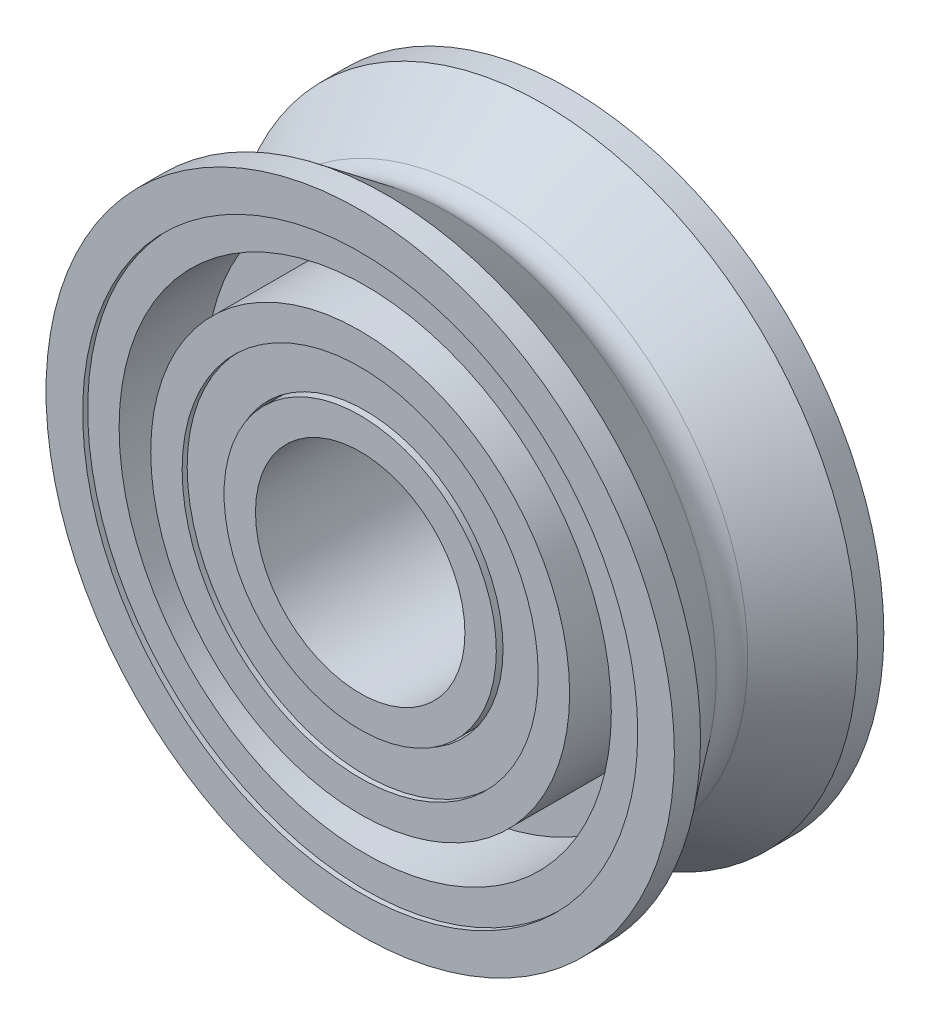
from build123d import *

# Parameters (mm, degrees)
CUT_EXTRUDE_THIN1_DEPTH      = 7.919752073
CUT_EXTRUDE_THIN1_DEPTH_BACK = 7.919752073
SKETCH2_R                    = 2.08915
SKETCH2_R_2                  = 2.06375


with BuildPart() as part:
    # Sketch1 → Revolve1 (revolve)
    with BuildSketch(Plane(origin=(0, 0, 0), x_dir=(0, 0, -1), z_dir=(1, 0, 0)), mode=Mode.PRIVATE) as revolve1_sk:
        with BuildLine():
            Line((1.190625, 4.7625), (1.5875, 4.7625))
            Line((1.5875, 4.7625), (1.5875, 4.206875))
            Line((1.5875, 4.206875), (1.5113, 4.206875))
            Line((1.5113, 4.206875), (1.5113, 3.730625))
            Line((1.5113, 3.730625), (0.1984375, 3.730625))
            Line((0.1984375, 3.730625), (0.1984375, 3.175))
            Line((0.1984375, 3.175), (1.5875, 3.175))
            Line((1.5875, 3.175), (1.5875, 2.69875))
            Line((1.5875, 2.69875), (1.5113, 2.69875))
            Line((1.5113, 2.69875), (1.5113, 2.06375))
            Line((1.5113, 2.06375), (1.5875, 2.06375))
            Line((1.5875, 2.06375), (1.5875, 1.5875))
            Line((1.5875, 1.5875), (-1.5875, 1.5875))
            Line((-1.5875, 1.5875), (-1.5875, 2.06375))
            Line((-1.5875, 2.06375), (-1.5113, 2.06375))
            Line((-1.5113, 2.06375), (-1.5113, 2.69875))
            Line((-1.5113, 2.69875), (-1.5875, 2.69875))
            Line((-1.5875, 2.69875), (-1.5875, 3.175))
            Line((-1.5875, 3.175), (-0.1984375, 3.175))
            Line((-0.1984375, 3.175), (-0.1984375, 3.730625))
            Line((-0.1984375, 3.730625), (-1.5113, 3.730625))
            Line((-1.5113, 3.730625), (-1.5113, 4.206875))
            Line((-1.5113, 4.206875), (-1.5875, 4.206875))
            Line((-1.5875, 4.206875), (-1.5875, 4.7625))
            Line((-1.5875, 4.7625), (-1.190625, 4.7625))
            Line((-1.190625, 4.7625), (-0.238125, 4.048125))
            ThreePointArc((-0.238125, 4.048125), (0, 3.96875), (0.238125, 4.048125))
            Line((0.238125, 4.048125), (1.190625, 4.7625))
        make_face()
    revolve(revolve1_sk.sketch.rotate(Axis((0, 0, 1.5875), (0, 0, -1)), 90), axis=Axis((0, 0, 1.5875), (0, 0, -1)))

    # Sketch2 → Cut-Extrude-Thin1 (cut, two sides: drawn at the far end of the back side and taken through both)
    with BuildSketch(Plane.XY.offset(-CUT_EXTRUDE_THIN1_DEPTH_BACK)):
        Circle(SKETCH2_R)
        Circle(SKETCH2_R_2, mode=Mode.SUBTRACT)
    extrude(amount=CUT_EXTRUDE_THIN1_DEPTH + CUT_EXTRUDE_THIN1_DEPTH_BACK, mode=Mode.SUBTRACT)


with BuildPart() as cut_extrude_thin1_piece_1:
    # of the separate pieces the step leaves, piece 1, a body of its own (cut_extrude_thin1_pieces)
    add(part.part.solids().sort_by_distance((4.048125, 0, 0.238125))[0])


with BuildPart() as cut_extrude_thin1_piece_2:
    # of the separate pieces the step leaves, piece 2, a body of its own (cut_extrude_thin1_pieces)
    add(part.part.solids().sort_by_distance((2.06375, 0, 1.5875))[0])


solid = Compound([cut_extrude_thin1_piece_1.part, cut_extrude_thin1_piece_2.part])
